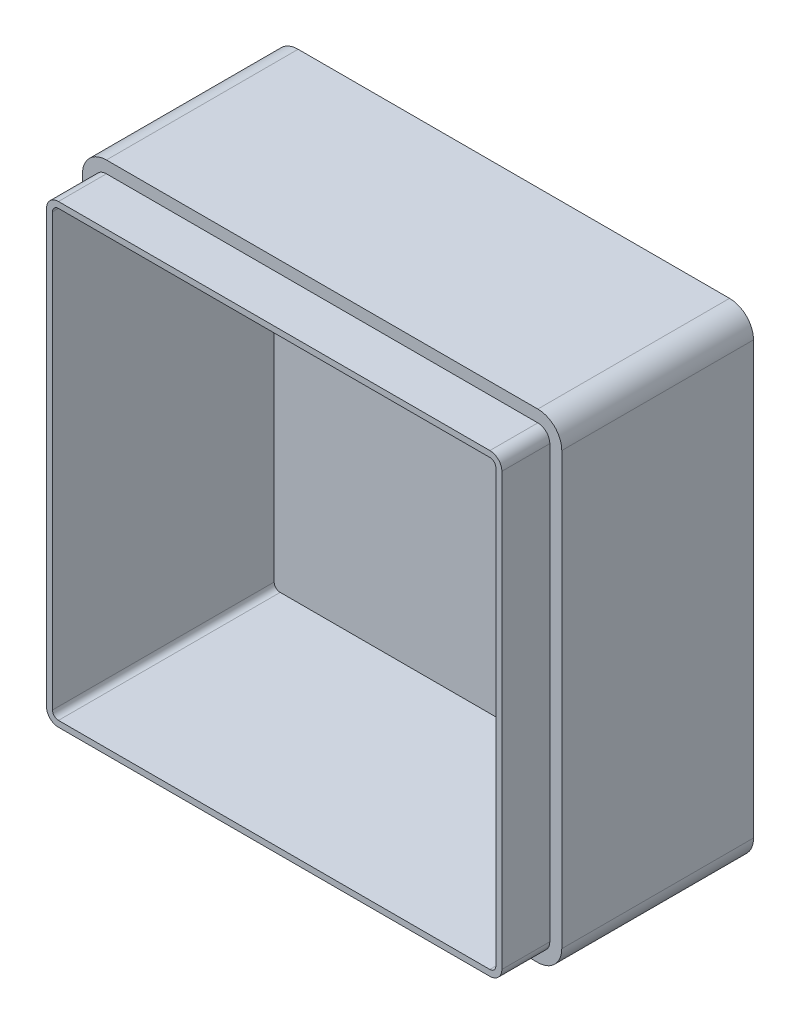
from build123d import *

# Parameters (mm, degrees)
SKETCH2_W          = 254
SKETCH2_H          = 254
EXTRUDE1_DEPTH     = 127
FILLET1_R          = 12.7
SHELL1_T           = -9.525
CUT_EXTRUDE1_DEPTH = 25.4


with BuildPart() as part:
    # Sketch2 → Extrude1 (new body)
    with BuildSketch(Plane.XY):
        with Locations((127, 127)):
            Rectangle(SKETCH2_W, SKETCH2_H)
    extrude(amount=EXTRUDE1_DEPTH)

    # Fillet1
    fillet1_edges = [part.edges().sort_by_distance(p)[0] for p in [
        (0, 254, 63.5),
        (254, 254, 63.5),
        (254, 0, 63.5),
        (0, 0, 63.5),
    ]]
    fillet(fillet1_edges, radius=FILLET1_R)

    # Shell1
    shell1_openings = [part.faces().sort_by_distance(p)[0] for p in [
        (127, 127, 127),
    ]]
    offset(amount=SHELL1_T, openings=shell1_openings, kind=Kind.INTERSECTION)

    # Sketch3 → Cut-Extrude1 (cut)
    with BuildSketch(Plane.XY.offset(127)):
        with BuildLine():
            Line((0, 241.3), (0, 12.7))
            ThreePointArc((0, 12.7), (3.719743879, 3.719743879), (12.7, 0))
            Line((12.7, 0), (241.3, 0))
            ThreePointArc((241.3, 0), (250.280256121, 3.719743879), (254, 12.7))
            Line((254, 12.7), (254, 241.3))
            ThreePointArc((254, 241.3), (250.280256121, 250.280256121), (241.3, 254))
            Line((241.3, 254), (12.7, 254))
            ThreePointArc((12.7, 254), (3.719743879, 250.280256121), (0, 241.3))
        make_face()
        with BuildLine():
            Line((6.35, 241.3), (6.35, 12.7))
            ThreePointArc((6.35, 12.7), (8.209871939, 8.209871939), (12.7, 6.35))
            Line((12.7, 6.35), (241.3, 6.35))
            ThreePointArc((241.3, 6.35), (245.790128061, 8.209871939), (247.65, 12.7))
            Line((247.65, 12.7), (247.65, 241.3))
            ThreePointArc((247.65, 241.3), (245.790128061, 245.790128061), (241.3, 247.65))
            Line((241.3, 247.65), (12.7, 247.65))
            ThreePointArc((12.7, 247.65), (8.209871939, 245.790128061), (6.35, 241.3))
        make_face(mode=Mode.SUBTRACT)
    extrude(amount=-CUT_EXTRUDE1_DEPTH, mode=Mode.SUBTRACT)


solid = part.part
